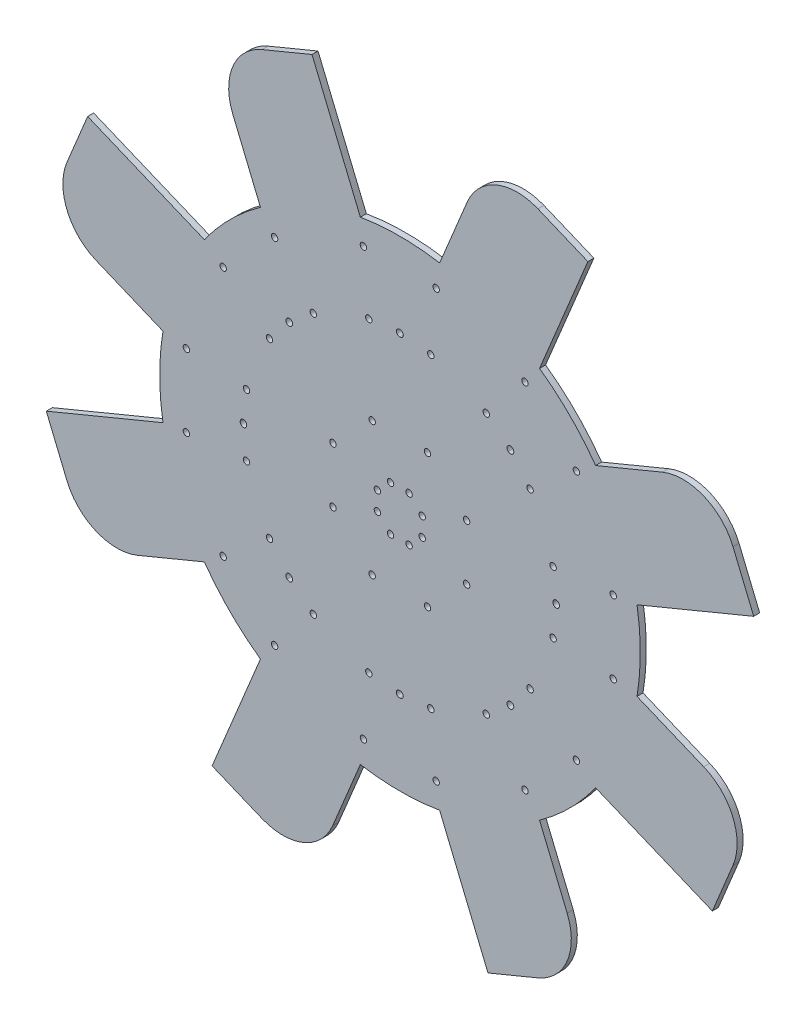
from build123d import *

# Parameters (mm, degrees)
SKETCH1_R            = 127
BOSS_EXTRUDE1_DEPTH  = 3.175
M3_CLEARANCE_HOLE1_D = 3.4
CIRPATTERN1_COUNT    = 8
BOSS_EXTRUDE2_DEPTH  = 3.175
CIRPATTERN2_COUNT    = 8


with BuildPart() as part:
    # Sketch1 → Boss-Extrude1 (new body)
    with BuildSketch(Plane.XY):
        Circle(SKETCH1_R)
    extrude(amount=BOSS_EXTRUDE1_DEPTH)

    # M3 Clearance Hole1 (through all)
    with Locations(Plane(origin=(0, 0, 0), x_dir=(-1, 0, 0), z_dir=(0, 0, -1))):
        with Locations((-58.2494214, 58.493652703), (-82.549819355, -0.172697611), (-93.238867767, 66.113565457), (-112.679186132, 19.180485205), (-11.733270063, 4.860079591), (-68.767621753, 45.667457762), (-80.917820731, 16.334282605), (-35.199810189, 14.580238773)):
            m3_clearance_hole1 = Hole(M3_CLEARANCE_HOLE1_D / 2)

    # CirPattern1: M3 Clearance Hole1 ×8 about axis
    cirpattern1_axis = Axis((-0.09749486, -0.040383693, 0), (0, 0, 1))
    for i in range(1, CIRPATTERN1_COUNT):
        add(m3_clearance_hole1.rotate(cirpattern1_axis, i * 360 / CIRPATTERN1_COUNT), mode=Mode.SUBTRACT)

    # Sketch6 → Boss-Extrude2 (add)
    with BuildSketch(Plane(origin=(0, 0, 0), x_dir=(-1, 0, 0), z_dir=(0, 0, -1))):
        with BuildLine():
            Line((-100.530886518, 72.570613756), (-138.664014222, 88.365872427))
            ThreePointArc((-138.664014222, 88.365872427), (-160.534372382, 88.365872427), (-175.999050943, 72.901193866))
            Line((-175.999050943, 72.901193866), (-186.934230023, 46.501336224))
            Line((-186.934230023, 46.501336224), (-122.401244677, 19.770898473))
            Line((-122.401244677, 19.770898473), (-100.530886518, 72.570613756))
        make_face()
    boss_extrude2 = extrude(amount=-BOSS_EXTRUDE2_DEPTH)

    # CirPattern2: Boss-Extrude2 ×8 about axis
    cirpattern2_axis = Axis((0, 0, 0), (0, 0, 1))
    for i in range(1, CIRPATTERN2_COUNT):
        add(boss_extrude2.rotate(cirpattern2_axis, i * 360 / CIRPATTERN2_COUNT))


solid = part.part
